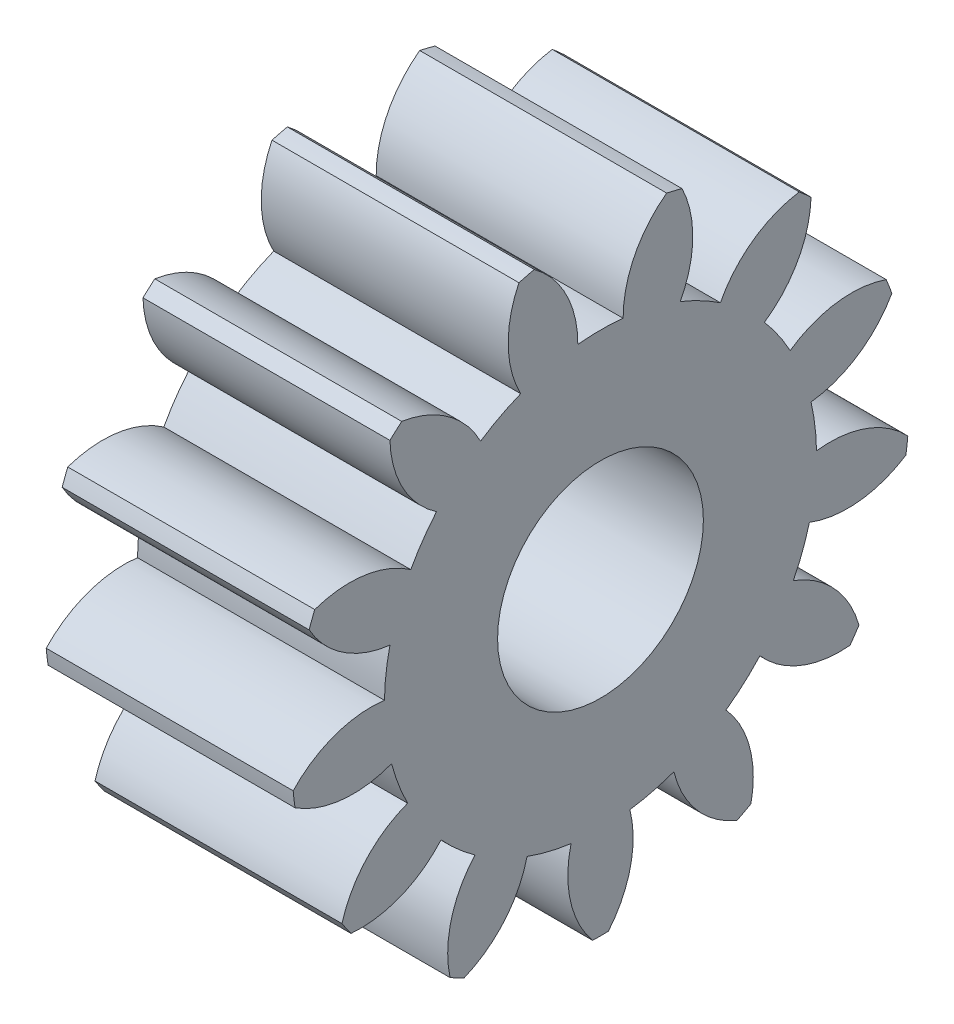
from build123d import *

# Parameters (mm, degrees)
BASPROSKE_W     = 6
BASPROSKE_H     = 7.5
TOOTHCUT_DEPTH  = 13.186057607
TEETHCUTS_COUNT = 13
TEETHCUTS_ANGLE = 332.307692308
BORSKE_R        = 2.5
BORE_DEPTH      = 50.0000508


with BuildPart() as part:
    # BasProSke → Base-Revolve (revolve)
    with BuildSketch(Plane(origin=(0, 0, 0), x_dir=(1, 0, 0), z_dir=(0, 1, 0)), mode=Mode.PRIVATE) as base_revolve_sk:
        with Locations((3, 3.75)):
            Rectangle(BASPROSKE_W, BASPROSKE_H)
    revolve(base_revolve_sk.sketch.rotate(Axis((-10, 0, 0), (1, 0, 0)), 180), axis=Axis((-10, 0, 0), (1, 0, 0)))

    # TooCutSke → ToothCut (cut, through all)
    with BuildSketch(Plane(origin=(0, 0, 0), x_dir=(0, 0, -1), z_dir=(1, 0, 0))):
        with BuildLine():
            ThreePointArc((0.550489643, 5.220053846), (0, 5.249), (-0.550489643, 5.220053846))
            ThreePointArc((-0.550489643, 5.220053846), (-0.834571714, 6.414617604), (-1.635166801, 7.345602405))
            ThreePointArc((-1.635166801, 7.345602405), (0, 7.5254), (1.635166801, 7.345602405))
            ThreePointArc((1.635166801, 7.345602405), (0.834571714, 6.414617604), (0.550489643, 5.220053846))
        make_face()
    toothcut = extrude(amount=TOOTHCUT_DEPTH, mode=Mode.SUBTRACT)

    # TeethCuts: ToothCut ×13 about axis
    teethcuts_axis = Axis((-10, 0, 0), (1, 0, 0))
    for i in range(1, TEETHCUTS_COUNT):
        add(toothcut.rotate(teethcuts_axis, i * TEETHCUTS_ANGLE / (TEETHCUTS_COUNT - 1)), mode=Mode.SUBTRACT)

    # BorSke → Bore (cut, symmetric)
    with BuildSketch(Plane(origin=(0, 0, 0), x_dir=(0, 0, -1), z_dir=(1, 0, 0))):
        with Locations(Location((0, 0, 0), (0, 0, 180))):
            Circle(BORSKE_R)
    extrude(amount=BORE_DEPTH, both=True, mode=Mode.SUBTRACT)


solid = part.part
